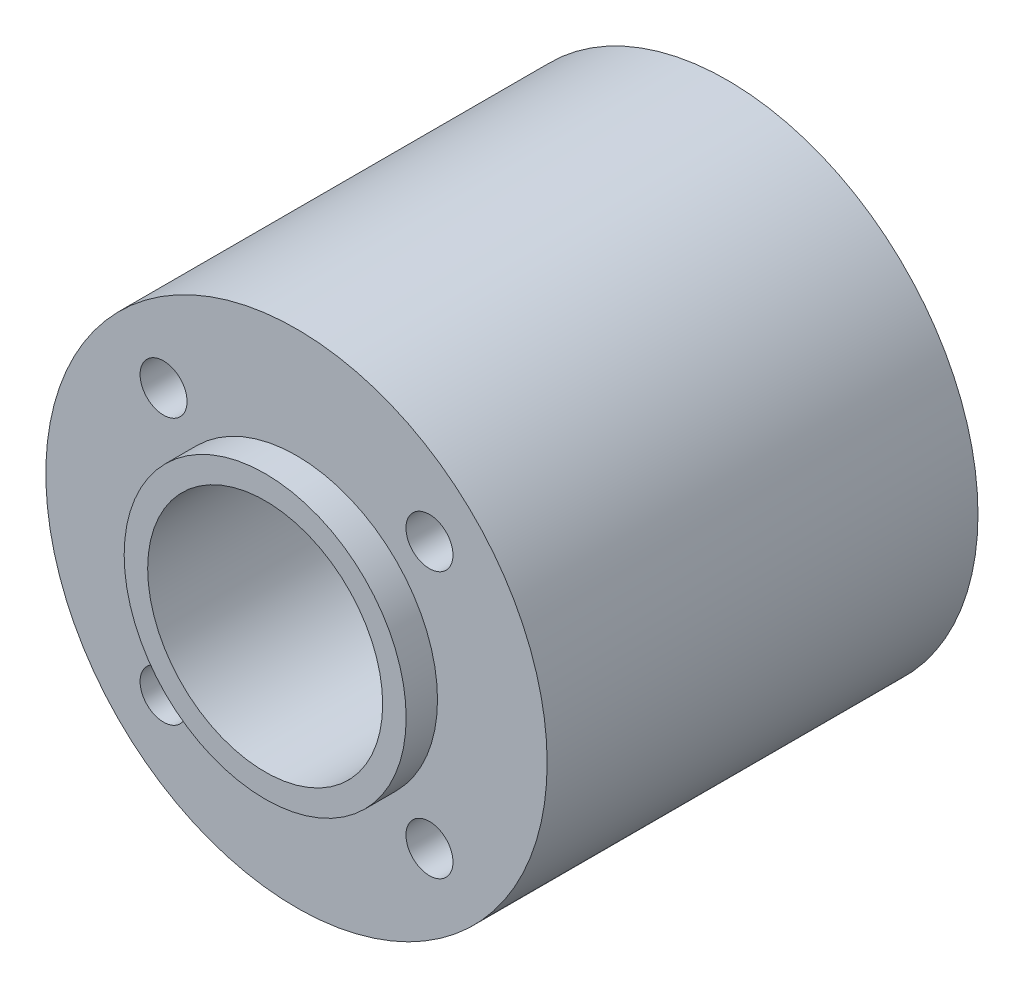
from build123d import *

# Parameters (mm, degrees)
SKETCH1_R           = 16
SKETCH1_R_2         = 9
SKETCH1_R_3         = 7.5
BOSS_EXTRUDE1_DEPTH = 27.5
BOSS_EXTRUDE2_START = 2
SKETCH1_3_R         = 9
SKETCH1_3_R_2       = 7.5
BOSS_EXTRUDE2_DEPTH = 2
BOSS_EXTRUDE4_START = -27.5
SKETCH1_5_R         = 9
SKETCH1_5_R_2       = 7.5
BOSS_EXTRUDE4_DEPTH = 2
SKETCH2_R           = 1.5
CUT_EXTRUDE1_DEPTH  = 38.17862289


with BuildPart() as part:
    # Sketch1 → Boss-Extrude1 (new body)
    # profile 1 of 2: a face of its own
    with BuildSketch(Plane.XY):
        Circle(SKETCH1_R)
        Circle(SKETCH1_R_2, mode=Mode.SUBTRACT)
    # profile 2 of 2: a face of its own
    with BuildSketch(Plane.XY):
        Circle(SKETCH1_R_2)
        Circle(SKETCH1_R_3, mode=Mode.SUBTRACT)
    extrude(amount=-BOSS_EXTRUDE1_DEPTH)

    # Sketch1<3> → Boss-Extrude2 (add)
    with BuildSketch(Plane.XY.offset(BOSS_EXTRUDE2_START)):
        Circle(SKETCH1_3_R)
        Circle(SKETCH1_3_R_2, mode=Mode.SUBTRACT)
    extrude(amount=-BOSS_EXTRUDE2_DEPTH)

    # Sketch1<5> → Boss-Extrude4 (add)
    with BuildSketch(Plane.XY.offset(BOSS_EXTRUDE4_START)):
        Circle(SKETCH1_5_R)
        Circle(SKETCH1_5_R_2, mode=Mode.SUBTRACT)
    extrude(amount=-BOSS_EXTRUDE4_DEPTH)

    # Sketch2 → Cut-Extrude1 (cut, through all)
    with BuildSketch(Plane.XY):
        with Locations((-8.485281315, 8.485281433)):
            Circle(SKETCH2_R)
        with Locations((8.486281315, 8.486281433)):
            Circle(SKETCH2_R)
        with Locations((8.487281374, -8.485281256)):
            Circle(SKETCH2_R)
        with Locations((-8.484281315, -8.486281315)):
            Circle(SKETCH2_R)
    extrude(amount=-CUT_EXTRUDE1_DEPTH, mode=Mode.SUBTRACT)


solid = part.part
